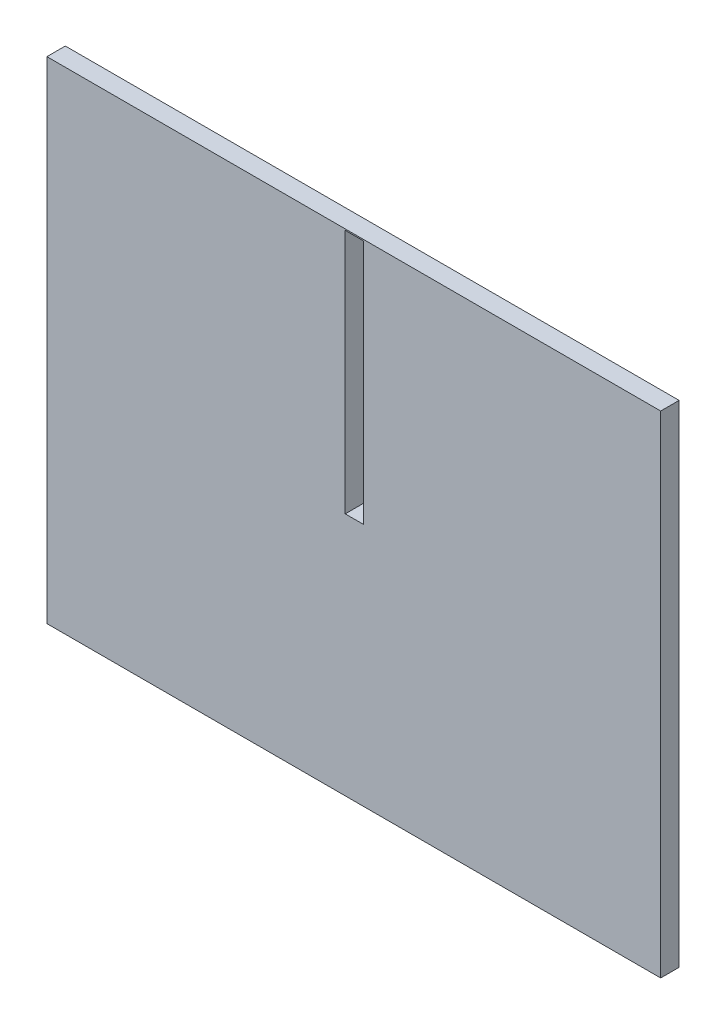
from build123d import *

# Parameters (mm, degrees)
SKETCH1_W               = 100
SKETCH1_H               = 80
BOSS_EXTRUDE1_DEPTH     = 3
CUT_EXTRUDE1_DEPTH      = 22
CUT_EXTRUDE1_DEPTH_BACK = 13
SKETCH2_W               = 3
SKETCH2_H               = 40


with BuildPart() as part:
    # Sketch1 → Boss-Extrude1 (new body)
    with BuildSketch(Plane.XY):
        Rectangle(SKETCH1_W, SKETCH1_H)
    extrude(amount=BOSS_EXTRUDE1_DEPTH)

    # Sketch2 → Cut-Extrude1 (cut, two sides: drawn at the far end of the back side and taken through both)
    with BuildSketch(Plane.XY.offset(3).offset(-CUT_EXTRUDE1_DEPTH_BACK)):
        with Locations((0.105052813, 19.789894374)):
            Rectangle(SKETCH2_W, SKETCH2_H)
    extrude(amount=CUT_EXTRUDE1_DEPTH + CUT_EXTRUDE1_DEPTH_BACK, mode=Mode.SUBTRACT)


solid = part.part
